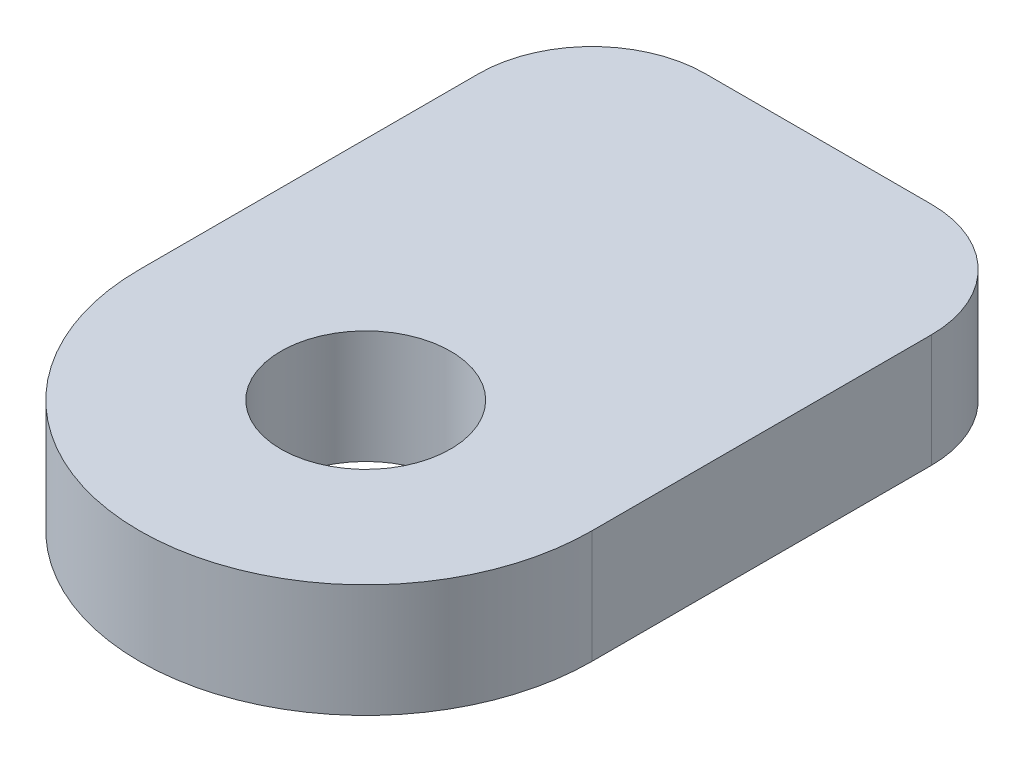
from build123d import *

# Parameters (mm, degrees)
SKETCH1_R           = 3
BOSS_EXTRUDE1_DEPTH = 4
FILLET1_R           = 4


with BuildPart() as part:
    # Sketch1 → Boss-Extrude1 (new body)
    with BuildSketch(Plane(origin=(0, 0, 0), x_dir=(1, 0, 0), z_dir=(0, 1, 0))):
        with BuildLine():
            Line((-8, 0), (-8, 16))
            Line((-8, 16), (8, 16))
            Line((8, 16), (8, 0))
            ThreePointArc((8, 0), (0, -8), (-8, 0))
        make_face()
        with Locations(Location((0, 0, 0), (0, 0, 270))):
            Circle(SKETCH1_R, mode=Mode.SUBTRACT)
    extrude(amount=BOSS_EXTRUDE1_DEPTH)

    # Fillet1
    fillet1_edges = [part.edges().sort_by_distance(p)[0] for p in [
        (-8, 2, -16),
        (8, 2, -16),
    ]]
    fillet(fillet1_edges, radius=FILLET1_R)


solid = part.part
